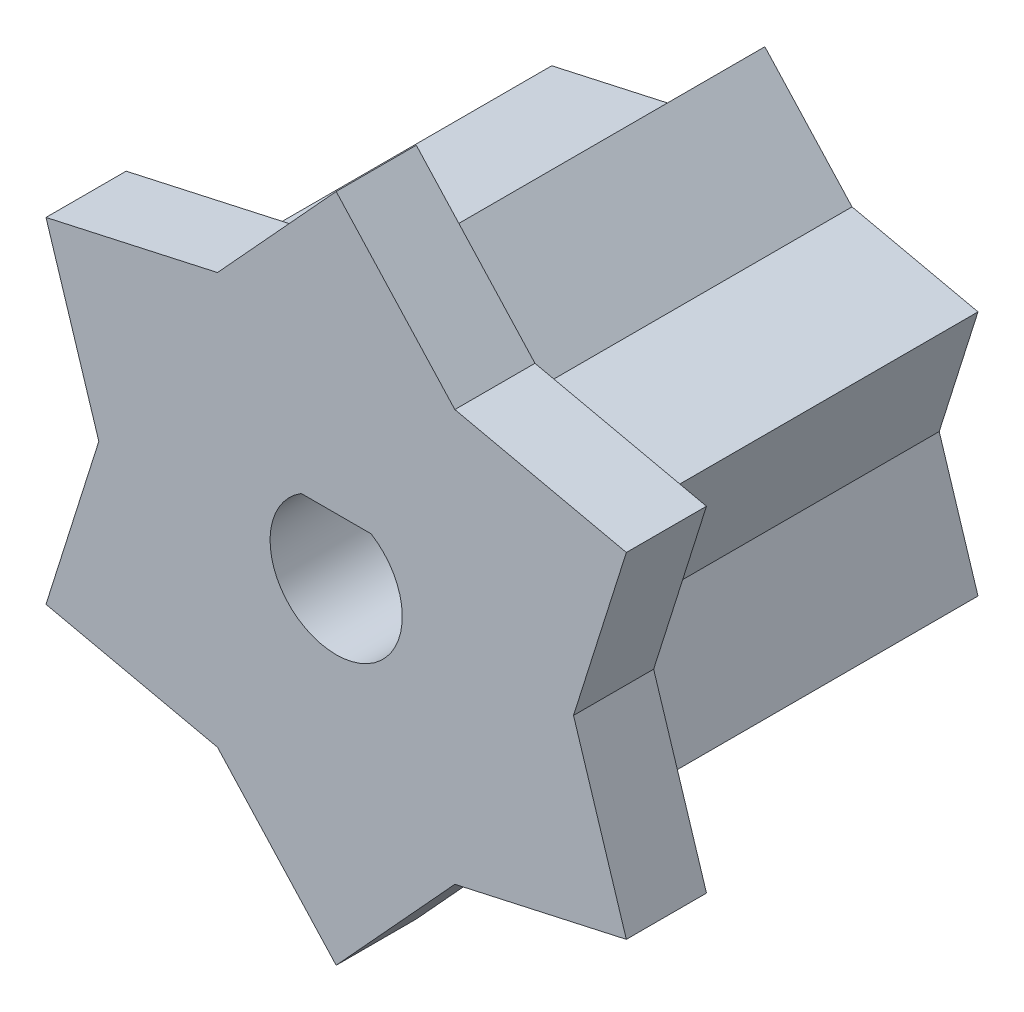
from build123d import *

# Parameters (mm, degrees)
BOSS_EXTRUDE1_DEPTH = 8.7
BOSS_EXTRUDE2_DEPTH = 2
CUT_EXTRUDE2_DEPTH  = 16.391110731
CHAMFER1_SIZE       = 0.4


with BuildPart() as part:
    # Sketch1 → Boss-Extrude1 (new body)
    with BuildSketch(Plane.XY):
        Polygon((2.175697935, 3.768419365), (0, 6.142777017), (-2.175697935, 3.768419365), (-5.319800946, 3.071388508), (-4.351395869, 0), (-5.319800946, -3.071388508), (-2.175697935, -3.768419365), (0, -6.142777017), (2.175697935, -3.768419365), (5.319800946, -3.071388508), (4.351395869, 0), (5.319800946, 3.071388508), align=None)
    extrude(amount=-BOSS_EXTRUDE1_DEPTH)

    # Sketch2 → Boss-Extrude2 (add)
    with BuildSketch(Plane.XY):
        Polygon((7.242620565, 4.181528933), (2.962094779, 5.130498653), (0, 8.363057866), (-2.962094779, 5.130498653), (-7.242620565, 4.181528933), (-5.924189557, 0), (-7.242620565, -4.181528933), (-2.962094779, -5.130498653), (0, -8.363057866), (2.962094779, -5.130498653), (7.242620565, -4.181528933), (5.924189557, 0), align=None)
    extrude(amount=BOSS_EXTRUDE2_DEPTH)

    # Sketch3 → Cut-Extrude2 (cut, through all)
    with BuildSketch(Plane.XY.offset(2)):
        with BuildLine():
            ThreePointArc((1.65, 0), (1.442792528, 0.800530899), (0.87321246, 1.4))
            Line((0.87321246, 1.4), (-0.87321246, 1.4))
            ThreePointArc((-0.87321246, 1.4), (-1.442792528, 0.800530899), (-1.65, 0))
            ThreePointArc((-1.65, 0), (0, -1.65), (1.65, 0))
        make_face()
    extrude(amount=-CUT_EXTRUDE2_DEPTH, mode=Mode.SUBTRACT)

    # Chamfer1
    chamfer1_edges = [part.edges().sort_by_distance(p)[0] for p in [
        (3.74774944, -3.419903937, 0),
        (1.087848967, -4.955598191, 0),
        (-1.087848967, -4.955598191, 0),
        (-3.74774944, -3.419903937, 0),
        (-4.835598408, -1.535694254, 0),
        (-4.835598408, 1.535694254, 0),
        (-3.74774944, 3.419903937, 0),
        (4.835598408, -1.535694254, 0),
        (4.835598408, 1.535694254, 0),
        (3.74774944, 3.419903937, 0),
        (1.087848967, 4.955598191, 0),
        (-1.087848967, 4.955598191, 0),
    ]]
    chamfer(chamfer1_edges, length=CHAMFER1_SIZE)


solid = part.part
